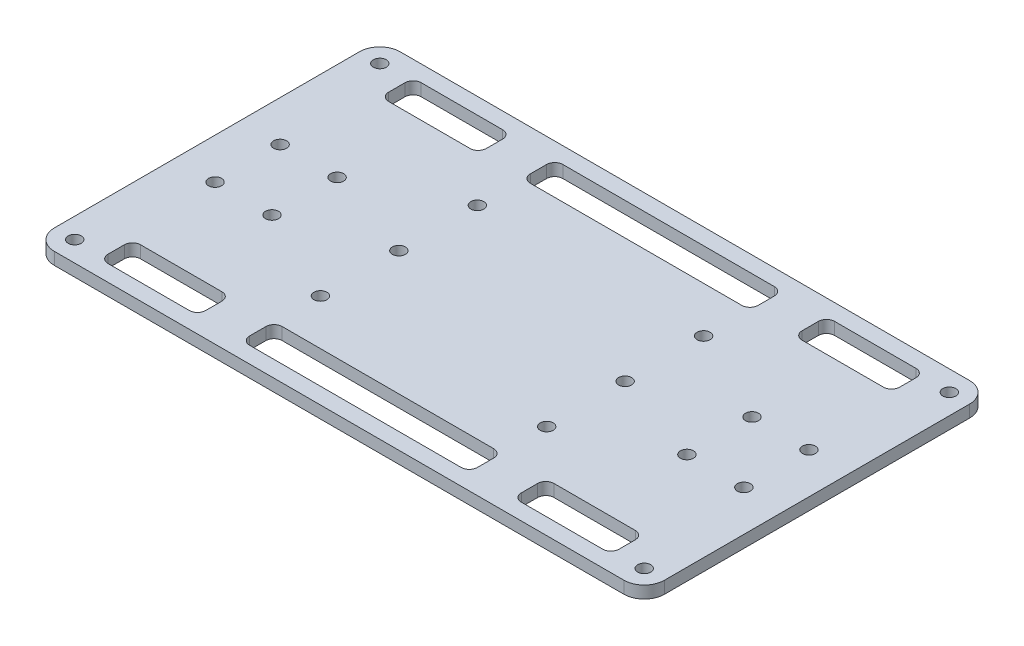
from build123d import *

# Parameters (mm, degrees)
SKETCH1_R           = 1.6
BOSS_EXTRUDE1_DEPTH = 3


with BuildPart() as part:
    # Sketch1 → Boss-Extrude1 (new body)
    with BuildSketch(Plane(origin=(0, 0, 0), x_dir=(1, 0, 0), z_dir=(0, 1, 0))):
        with BuildLine():
            Line((-70, 42.5), (70, 42.5))
            ThreePointArc((70, 42.5), (73.535533906, 41.035533906), (75, 37.5))
            Line((75, 37.5), (75, -37.5))
            ThreePointArc((75, -37.5), (73.535533906, -41.035533906), (70, -42.5))
            Line((70, -42.5), (-70, -42.5))
            ThreePointArc((-70, -42.5), (-73.535533906, -41.035533906), (-75, -37.5))
            Line((-75, -37.5), (-75, 37.5))
            ThreePointArc((-75, 37.5), (-73.535533906, 41.035533906), (-70, 42.5))
        make_face()
        with Locations(Location((-65, 8, 0), (0, 0, 270))):
            Circle(SKETCH1_R, mode=Mode.SUBTRACT)
        with Locations(Location((-65, -8, 0), (0, 0, 90))):
            Circle(SKETCH1_R, mode=Mode.SUBTRACT)
        with Locations(Location((-51, 8, 0), (0, 0, 90))):
            Circle(SKETCH1_R, mode=Mode.SUBTRACT)
        with Locations(Location((-51, -8, 0), (0, 0, 270))):
            Circle(SKETCH1_R, mode=Mode.SUBTRACT)
        with Locations(Location((51, -8, 0), (0, 0, 90))):
            Circle(SKETCH1_R, mode=Mode.SUBTRACT)
        with Locations(Location((51, 8, 0), (0, 0, 270))):
            Circle(SKETCH1_R, mode=Mode.SUBTRACT)
        with Locations(Location((65, -8, 0), (0, 0, 270))):
            Circle(SKETCH1_R, mode=Mode.SUBTRACT)
        with Locations(Location((65, 8, 0), (0, 0, 90))):
            Circle(SKETCH1_R, mode=Mode.SUBTRACT)
        with Locations(Location((-27.81, 19.29, 0), (0, 0, 270))):
            Circle(SKETCH1_R, mode=Mode.SUBTRACT)
        with Locations(Location((-27.81, 0, 0), (0, 0, 270))):
            Circle(SKETCH1_R, mode=Mode.SUBTRACT)
        with Locations(Location((-27.81, -19.29, 0), (0, 0, 90))):
            Circle(SKETCH1_R, mode=Mode.SUBTRACT)
        with Locations(Location((27.81, -19.29, 0), (0, 0, 270))):
            Circle(SKETCH1_R, mode=Mode.SUBTRACT)
        with Locations(Location((27.81, 19.29, 0), (0, 0, 90))):
            Circle(SKETCH1_R, mode=Mode.SUBTRACT)
        with Locations(Location((27.81, 0, 0), (0, 0, 90))):
            Circle(SKETCH1_R, mode=Mode.SUBTRACT)
        with Locations(Location((-70, 37.5, 0), (0, 0, 270))):
            Circle(SKETCH1_R, mode=Mode.SUBTRACT)
        with Locations(Location((-70, -37.5, 0), (0, 0, 90))):
            Circle(SKETCH1_R, mode=Mode.SUBTRACT)
        with Locations(Location((70, -37.5, 0), (0, 0, 270))):
            Circle(SKETCH1_R, mode=Mode.SUBTRACT)
        with Locations(Location((70, 37.5, 0), (0, 0, 90))):
            Circle(SKETCH1_R, mode=Mode.SUBTRACT)
        with BuildLine():
            Line((28, 32.5), (28, 36.5))
            ThreePointArc((28, 36.5), (27.414213562, 37.914213562), (26, 38.5))
            Line((26, 38.5), (-26, 38.5))
            ThreePointArc((-26, 38.5), (-27.414213562, 37.914213562), (-28, 36.5))
            Line((-28, 36.5), (-28, 32.5))
            ThreePointArc((-28, 32.5), (-27.414213562, 31.085786438), (-26, 30.5))
            Line((-26, 30.5), (26, 30.5))
            ThreePointArc((26, 30.5), (27.414213562, 31.085786438), (28, 32.5))
        make_face(mode=Mode.SUBTRACT)
        with BuildLine():
            Line((-26, -30.5), (26, -30.5))
            ThreePointArc((26, -30.5), (27.414213562, -31.085786438), (28, -32.5))
            Line((28, -32.5), (28, -36.5))
            ThreePointArc((28, -36.5), (27.414213562, -37.914213562), (26, -38.5))
            Line((26, -38.5), (-26, -38.5))
            ThreePointArc((-26, -38.5), (-27.414213562, -37.914213562), (-28, -36.5))
            Line((-28, -36.5), (-28, -32.5))
            ThreePointArc((-28, -32.5), (-27.414213562, -31.085786438), (-26, -30.5))
        make_face(mode=Mode.SUBTRACT)
        with BuildLine():
            Line((-38.81, 32.5), (-38.81, 36.5))
            ThreePointArc((-38.81, 36.5), (-39.395786438, 37.914213562), (-40.81, 38.5))
            Line((-40.81, 38.5), (-60.81, 38.5))
            ThreePointArc((-60.81, 38.5), (-62.224213562, 37.914213562), (-62.81, 36.5))
            Line((-62.81, 36.5), (-62.81, 32.5))
            ThreePointArc((-62.81, 32.5), (-62.224213562, 31.085786438), (-60.81, 30.5))
            Line((-60.81, 30.5), (-40.81, 30.5))
            ThreePointArc((-40.81, 30.5), (-39.395786438, 31.085786438), (-38.81, 32.5))
        make_face(mode=Mode.SUBTRACT)
        with BuildLine():
            Line((-60.81, -30.5), (-40.81, -30.5))
            ThreePointArc((-40.81, -30.5), (-39.395786438, -31.085786438), (-38.81, -32.5))
            Line((-38.81, -32.5), (-38.81, -36.5))
            ThreePointArc((-38.81, -36.5), (-39.395786438, -37.914213562), (-40.81, -38.5))
            Line((-40.81, -38.5), (-60.81, -38.5))
            ThreePointArc((-60.81, -38.5), (-62.224213562, -37.914213562), (-62.81, -36.5))
            Line((-62.81, -36.5), (-62.81, -32.5))
            ThreePointArc((-62.81, -32.5), (-62.224213562, -31.085786438), (-60.81, -30.5))
        make_face(mode=Mode.SUBTRACT)
        with BuildLine():
            Line((38.81, 32.5), (38.81, 36.5))
            ThreePointArc((38.81, 36.5), (39.395786438, 37.914213562), (40.81, 38.5))
            Line((40.81, 38.5), (60.81, 38.5))
            ThreePointArc((60.81, 38.5), (62.224213562, 37.914213562), (62.81, 36.5))
            Line((62.81, 36.5), (62.81, 32.5))
            ThreePointArc((62.81, 32.5), (62.224213562, 31.085786438), (60.81, 30.5))
            Line((60.81, 30.5), (40.81, 30.5))
            ThreePointArc((40.81, 30.5), (39.395786438, 31.085786438), (38.81, 32.5))
        make_face(mode=Mode.SUBTRACT)
        with BuildLine():
            Line((38.81, -32.5), (38.81, -36.5))
            ThreePointArc((38.81, -36.5), (39.395786438, -37.914213562), (40.81, -38.5))
            Line((40.81, -38.5), (60.81, -38.5))
            ThreePointArc((60.81, -38.5), (62.224213562, -37.914213562), (62.81, -36.5))
            Line((62.81, -36.5), (62.81, -32.5))
            ThreePointArc((62.81, -32.5), (62.224213562, -31.085786438), (60.81, -30.5))
            Line((60.81, -30.5), (40.81, -30.5))
            ThreePointArc((40.81, -30.5), (39.395786438, -31.085786438), (38.81, -32.5))
        make_face(mode=Mode.SUBTRACT)
    extrude(amount=BOSS_EXTRUDE1_DEPTH)


solid = part.part
